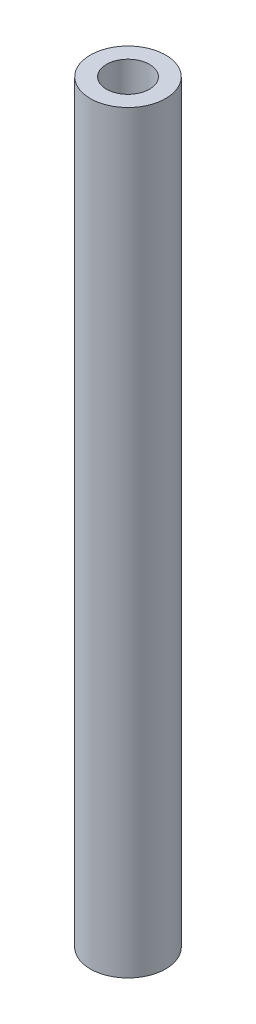
from build123d import *

# Parameters (mm, degrees)
SKETCH_1_R      = 1.75
SKETCH_1_R_2    = 1
EXTRUDE_1_DEPTH = 35


with BuildPart() as part:
    # 草图1 → 凸台-拉伸1 (new body)
    with BuildSketch(Plane(origin=(0, 0, 0), x_dir=(1, 0, 0), z_dir=(0, 1, 0))):
        with Locations(Location((0, 0, 0), (0, 0, 270))):
            Circle(SKETCH_1_R)
        with Locations(Location((0, 0, 0), (0, 0, 270))):
            Circle(SKETCH_1_R_2, mode=Mode.SUBTRACT)
    extrude(amount=EXTRUDE_1_DEPTH)


solid = part.part
